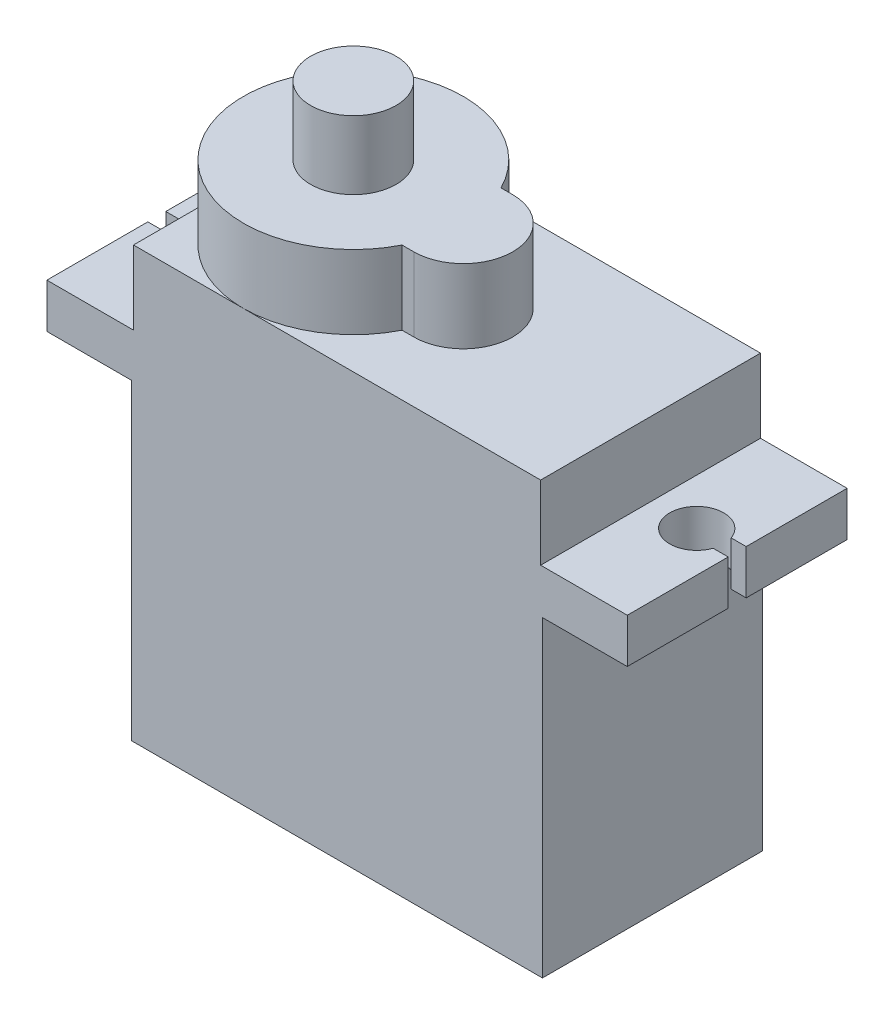
from build123d import *

# Parameters (mm, degrees)
SKETCH1_W           = 22.83
SKETCH1_H           = 12.22
BOSS_EXTRUDE1_DEPTH = 17.35
BOSS_EXTRUDE2_DEPTH = 2.47
SKETCH3_W           = 22.63
SKETCH3_H           = 12.22
BOSS_EXTRUDE3_DEPTH = 4.1
BOSS_EXTRUDE4_DEPTH = 4.1
SKETCH5_R           = 2.375
BOSS_EXTRUDE5_DEPTH = 3.8


with BuildPart() as part:
    # Sketch1 → Boss-Extrude1 (new body)
    with BuildSketch(Plane(origin=(0, 0, 0), x_dir=(1, 0, 0), z_dir=(0, 1, 0))):
        with Locations((11.415, 6.11)):
            Rectangle(SKETCH1_W, SKETCH1_H)
    extrude(amount=BOSS_EXTRUDE1_DEPTH)

    # Sketch2 → Boss-Extrude2 (add)
    with BuildSketch(Plane(origin=(0, 17.35, 0), x_dir=(1, 0, 0), z_dir=(0, 1, 0))):
        with BuildLine():
            Line((-4.715, 0), (27.545, 0))
            Line((27.545, 0), (27.545, 5.61))
            Line((27.545, 5.61), (26.709213562, 5.61))
            ThreePointArc((26.709213562, 5.61), (23.795, 6.11), (26.709213562, 6.61))
            Line((26.709213562, 6.61), (27.545, 6.61))
            Line((27.545, 6.61), (27.545, 12.22))
            Line((27.545, 12.22), (-4.715, 12.22))
            Line((-4.715, 12.22), (-4.715, 6.61))
            Line((-4.715, 6.61), (-3.879213562, 6.61))
            ThreePointArc((-3.879213562, 6.61), (-0.965, 6.11), (-3.879213562, 5.61))
            Line((-3.879213562, 5.61), (-4.715, 5.61))
            Line((-4.715, 5.61), (-4.715, 0))
        make_face()
    extrude(amount=BOSS_EXTRUDE2_DEPTH)

    # Sketch3 → Boss-Extrude3 (add)
    with BuildSketch(Plane(origin=(0, 19.82, 0), x_dir=(1, 0, 0), z_dir=(0, 1, 0))):
        with Locations((11.415, 6.11)):
            Rectangle(SKETCH3_W, SKETCH3_H)
    extrude(amount=BOSS_EXTRUDE3_DEPTH)

    # Sketch4 → Boss-Extrude4 (add)
    with BuildSketch(Plane(origin=(0, 23.92, 0), x_dir=(1, 0, 0), z_dir=(0, 1, 0))):
        with BuildLine():
            Line((12.32, 3.36), (11.666152491, 3.36))
            ThreePointArc((11.666152491, 3.36), (0.1, 6.11), (11.666152491, 8.86))
            Line((11.666152491, 8.86), (12.32, 8.86))
            ThreePointArc((12.32, 8.86), (15.07, 6.11), (12.32, 3.36))
        make_face()
    extrude(amount=BOSS_EXTRUDE4_DEPTH)

    # Sketch5 → Boss-Extrude5 (add)
    with BuildSketch(Plane(origin=(0, 28.02, 0), x_dir=(1, 0, 0), z_dir=(0, 1, 0))):
        with Locations(Location((6.21, 6.11, 0), (0, 0, 90))):
            Circle(SKETCH5_R)
    extrude(amount=BOSS_EXTRUDE5_DEPTH)


solid = part.part
